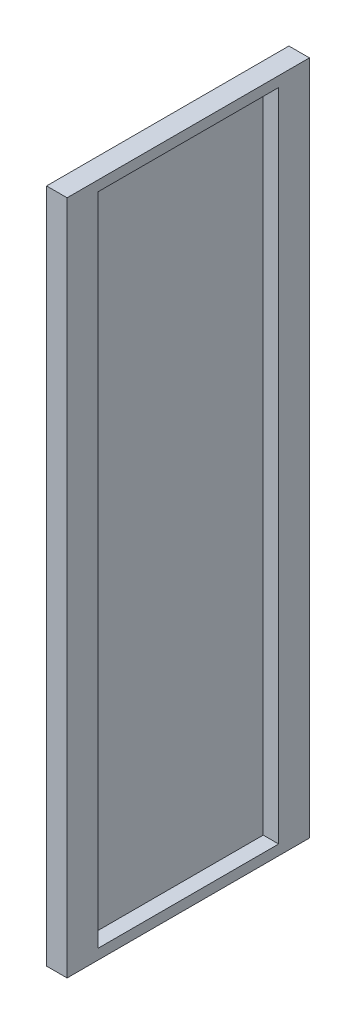
from build123d import *

# Parameters (mm, degrees)
SKETCH1_W           = 25.4
SKETCH1_H           = 299.72
BOSS_EXTRUDE1_DEPTH = 417.83
SKETCH2_W           = 223.52
SKETCH2_H           = 810.26
CUT_EXTRUDE1_DEPTH  = 19.05
SKETCH3_W           = 25.4
SKETCH3_H           = 118.11
CUT_EXTRUDE2_DEPTH  = 12.7


with BuildPart() as part:
    # Sketch1 → Boss-Extrude1 (new, symmetric)
    with BuildSketch(Plane(origin=(0, 0, 0), x_dir=(1, 0, 0), z_dir=(0, 1, 0))):
        Rectangle(SKETCH1_W, SKETCH1_H)
    extrude(amount=BOSS_EXTRUDE1_DEPTH, both=True)

    # Sketch2 → Cut-Extrude1 (cut)
    with BuildSketch(Plane(origin=(12.7, 0, 0), x_dir=(0, 0, -1), z_dir=(1, 0, 0))):
        Rectangle(SKETCH2_W, SKETCH2_H)
    extrude(amount=-CUT_EXTRUDE1_DEPTH, mode=Mode.SUBTRACT)

    # Sketch3 → Cut-Extrude2 (cut)
    with BuildSketch(Plane.ZY.offset(12.7)):
        with Locations((130.81, 231.775)):
            Rectangle(SKETCH3_W, SKETCH3_H)
    extrude(amount=-CUT_EXTRUDE2_DEPTH, mode=Mode.SUBTRACT)


solid = part.part
